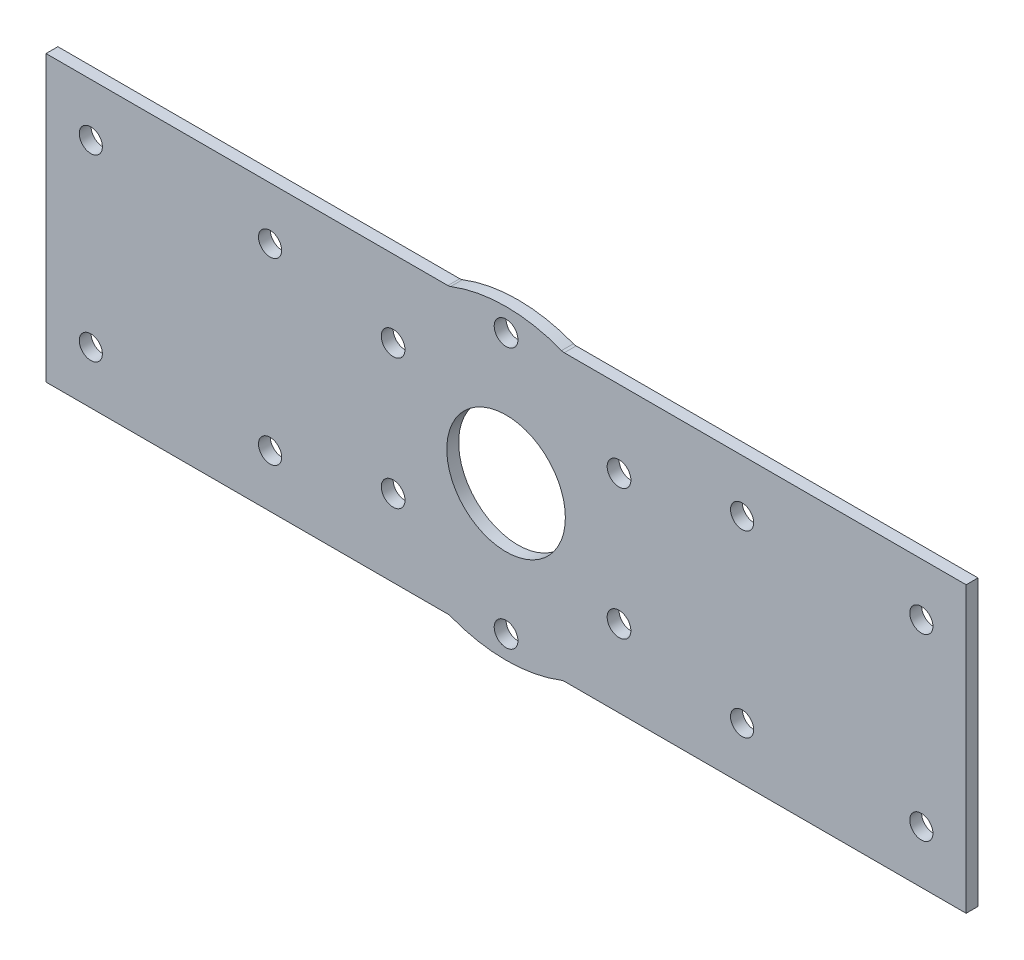
from build123d import *

# Parameters (mm, degrees)
SKETCH1_R           = 3.1
SKETCH1_R_2         = 3.175
SKETCH1_R_3         = 15.875
BOSS_EXTRUDE1_DEPTH = 1.5875
FILLET1_R           = 2


with BuildPart() as part:
    # Sketch1 → Boss-Extrude1 (new, symmetric)
    with BuildSketch(Plane.XY):
        with BuildLine():
            Line((-15.202382741, 38.1), (-123.202382741, 38.1))
            Line((-123.202382741, 38.1), (-123.202382741, -38.1))
            Line((-123.202382741, -38.1), (-15.202382741, -38.1))
            ThreePointArc((-15.202382741, -38.1), (0, -41.021), (15.202382741, -38.1))
            Line((15.202382741, -38.1), (123.202382741, -38.1))
            Line((123.202382741, -38.1), (123.202382741, 38.1))
            Line((123.202382741, 38.1), (15.202382741, 38.1))
            ThreePointArc((15.202382741, 38.1), (0, 41.021), (-15.202382741, 38.1))
        make_face()
        with Locations((-111.202382741, 24)):
            Circle(SKETCH1_R, mode=Mode.SUBTRACT)
        with Locations((-63.202382741, 24)):
            Circle(SKETCH1_R, mode=Mode.SUBTRACT)
        with Locations((-63.202382741, -24)):
            Circle(SKETCH1_R, mode=Mode.SUBTRACT)
        with Locations((-111.202382741, -24)):
            Circle(SKETCH1_R, mode=Mode.SUBTRACT)
        with Locations((111.202382741, -24)):
            Circle(SKETCH1_R, mode=Mode.SUBTRACT)
        with Locations((63.202382741, -24)):
            Circle(SKETCH1_R, mode=Mode.SUBTRACT)
        with Locations(Location((63.202382741, 24, 0), (0, 0, 180))):
            Circle(SKETCH1_R, mode=Mode.SUBTRACT)
        with Locations((111.202382741, 24)):
            Circle(SKETCH1_R, mode=Mode.SUBTRACT)
        with Locations((0, 34.925)):
            Circle(SKETCH1_R_2, mode=Mode.SUBTRACT)
        with Locations((30.245937227, 17.4625)):
            Circle(SKETCH1_R_2, mode=Mode.SUBTRACT)
        with Locations((30.245937227, -17.4625)):
            Circle(SKETCH1_R_2, mode=Mode.SUBTRACT)
        with Locations((0, -34.925)):
            Circle(SKETCH1_R_2, mode=Mode.SUBTRACT)
        with Locations((-30.245937227, -17.4625)):
            Circle(SKETCH1_R_2, mode=Mode.SUBTRACT)
        with Locations((-30.245937227, 17.4625)):
            Circle(SKETCH1_R_2, mode=Mode.SUBTRACT)
        Circle(SKETCH1_R_3, mode=Mode.SUBTRACT)
    extrude(amount=BOSS_EXTRUDE1_DEPTH, both=True)

    # Fillet1
    fillet1_edges = [part.edges().sort_by_distance(p)[0] for p in [
        (-15.202382741, 38.1, 0),
        (-15.202382741, -38.1, 0),
        (15.202382741, -38.1, 0),
        (15.202382741, 38.1, 0),
    ]]
    fillet(fillet1_edges, radius=FILLET1_R)


solid = part.part
